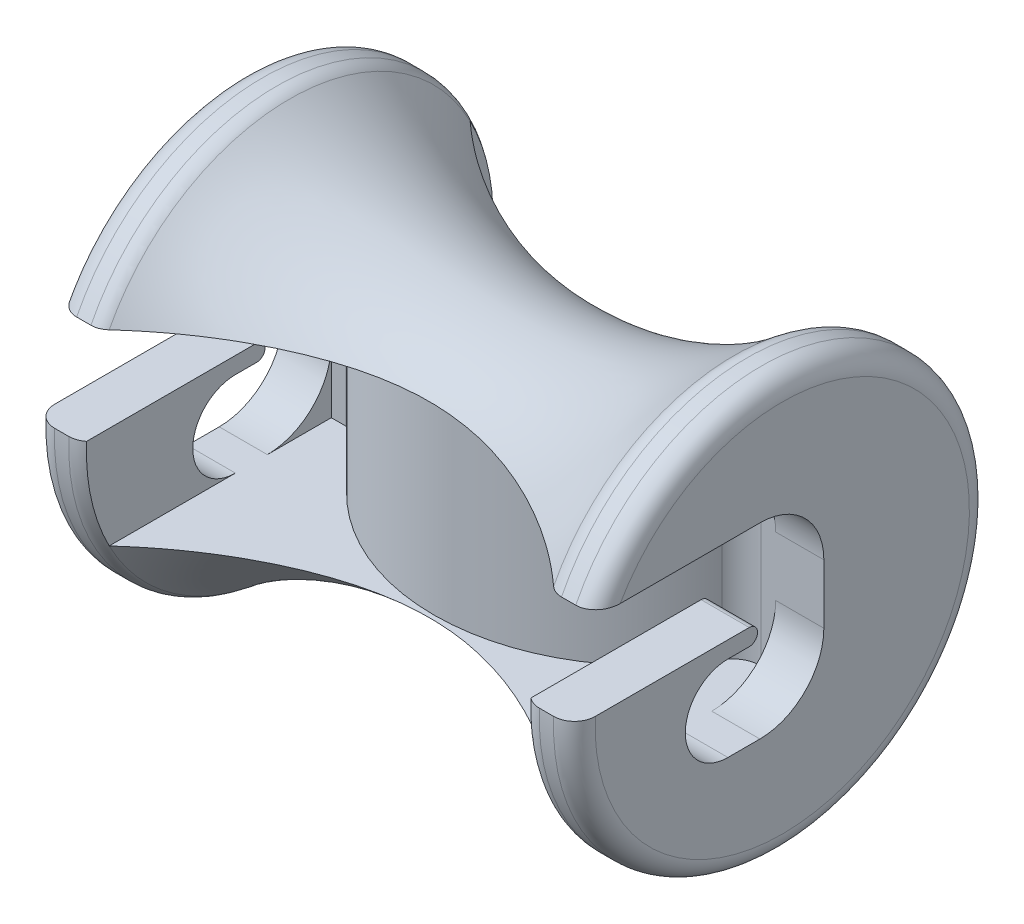
from build123d import *

# Parameters (mm, degrees)
CUT_EXTRUDE1_DEPTH            = 4.5
CUT_EXTRUDE4_REACH            = 31.597
CUT_EXTRUDE5_START            = -2.314830862
CUT_EXTRUDE5_DEPTH            = 2.314830862
CUT_EXTRUDE6_REACH            = 22.975
CUT_EXTRUDE6_END_MAJOR_RADIUS = 23
CUT_EXTRUDE6_END_MINOR_RADIUS = 17
SKETCH10_W                    = 21.370338276
SKETCH10_H                    = 4.1


with BuildPart() as part:
    # Sketch1 → Revolve1 (revolve)
    with BuildSketch(Plane(origin=(0, 0, 0), x_dir=(1, 0, 0), z_dir=(0, 1, 0)), mode=Mode.PRIVATE) as revolve1_sk:
        with BuildLine():
            Line((11.313708499, 10), (12, 10))
            ThreePointArc((12, 10), (12.707106781, 9.707106781), (13, 9))
            Line((13, 9), (13, 0))
            Line((13, 0), (-13, 0))
            Line((-13, 0), (-13, 9))
            ThreePointArc((-13, 9), (-12.707106781, 9.707106781), (-12, 10))
            Line((-12, 10), (-11.313708499, 10))
            ThreePointArc((-11.313708499, 10), (-10.980375166, 9.942809042), (-10.685169138, 9.777777778))
            ThreePointArc((-10.685169138, 9.777777778), (0, 6), (10.685169138, 9.777777778))
            ThreePointArc((10.685169138, 9.777777778), (10.980375166, 9.942809042), (11.313708499, 10))
        make_face()
    revolve(revolve1_sk.sketch.rotate(Axis((-13, 0, 0), (1, 0, 0)), 180), axis=Axis((-13, 0, 0), (1, 0, 0)))

    # Sketch3 → Cut-Extrude1 (cut, symmetric)
    with BuildSketch(Plane(origin=(0, 0, 0), x_dir=(1, 0, 0), z_dir=(0, 1, 0))):
        with BuildLine():
            Line((-9.147669138, -10), (9.147669138, -10))
            Line((9.147669138, -10), (10.685169138, -10))
            Line((10.685169138, -10), (10.685169138, 2))
            Line((10.685169138, 2), (9.969897363, 2))
            ThreePointArc((9.969897363, 2), (9.287033253, 1.817172167), (8.786871434, 1.31760479))
            ThreePointArc((8.786871434, 1.31760479), (0, -3.750854676), (-8.786871434, 1.31760479))
            ThreePointArc((-8.786871434, 1.31760479), (-9.287033253, 1.817172167), (-9.969897363, 2))
            Line((-9.969897363, 2), (-10.685169138, 2))
            Line((-10.685169138, 2), (-10.685169138, -10))
            Line((-10.685169138, -10), (-9.147669138, -10))
        make_face()
    extrude(amount=CUT_EXTRUDE1_DEPTH, both=True, mode=Mode.SUBTRACT)

    # Cut-Extrude4: up to this face of the body (flat: up to its plane)
    cut_extrude4_end = Plane(part.part.faces().sort_by_distance((-10.685169138, 0, 3.71495774))[0])
    # Sketch6 → Cut-Extrude4 (cut, up to the picked face)
    with BuildSketch(Plane.ZY.offset(13), mode=Mode.PRIVATE) as cut_extrude4_sk1:
        with BuildLine():
            Line((1.075, -4.5), (2.6125, -4.5))
            ThreePointArc((2.6125, -4.5), (4.6625, -2.45), (2.6125, -0.4))
            Line((2.6125, -0.4), (1.5875, -0.4))
            ThreePointArc((1.5875, -0.4), (1.1875, 0), (1.5875, 0.4))
            Line((1.5875, 0.4), (9.991996797, 0.4))
            ThreePointArc((9.991996797, 0.4), (9.680686562, 2.506852148), (8.93028555, 4.5))
            Line((8.93028555, 4.5), (1.075, 4.5))
            ThreePointArc((1.075, 4.5), (-1.099353352, 3.599353352), (-2, 1.425))
            Line((-2, 1.425), (-2, -1.425))
            ThreePointArc((-2, -1.425), (-1.099353352, -3.599353352), (1.075, -4.5))
        make_face()
    cut_extrude4_tool1 = split(extrude(cut_extrude4_sk1.sketch, amount=-CUT_EXTRUDE4_REACH, mode=Mode.PRIVATE), bisect_by=cut_extrude4_end, keep=Keep.BOTH, mode=Mode.PRIVATE)
    add(cut_extrude4_tool1.solids().sort_by(Axis((-13, 0.735249, 2.995386), (1, 0, 0)))[0], mode=Mode.SUBTRACT)

    # Sketch8 → Cut-Extrude5 (cut)
    with BuildSketch(Plane(origin=(13, 0, 0), x_dir=(0, 0, -1), z_dir=(1, 0, 0)).offset(CUT_EXTRUDE5_START)):
        with BuildLine():
            Line((-1.5875, 0.4), (-9.991996797, 0.4))
            ThreePointArc((-9.991996797, 0.4), (-9.680686562, 2.506852148), (-8.93028555, 4.5))
            Line((-8.93028555, 4.5), (-1.075, 4.5))
            ThreePointArc((-1.075, 4.5), (1.099353352, 3.599353352), (2, 1.425))
            Line((2, 1.425), (2, -1.425))
            ThreePointArc((2, -1.425), (1.099353352, -3.599353352), (-1.075, -4.5))
            Line((-1.075, -4.5), (-2.6125, -4.5))
            ThreePointArc((-2.6125, -4.5), (-4.6625, -2.45), (-2.6125, -0.4))
            Line((-2.6125, -0.4), (-1.5875, -0.4))
            ThreePointArc((-1.5875, -0.4), (-1.1875, 0), (-1.5875, 0.4))
        make_face()
    extrude(amount=CUT_EXTRUDE5_DEPTH, mode=Mode.SUBTRACT)

    # Cut-Extrude6: up to this torus (the profile starts outside it)
    cut_extrude6_end = Plane(origin=(0, 0, 0), z_dir=(-1, 0, 0)) * Torus(CUT_EXTRUDE6_END_MAJOR_RADIUS, CUT_EXTRUDE6_END_MINOR_RADIUS, mode=Mode.PRIVATE)
    # Sketch10 → Cut-Extrude6 (cut, up to the surface)
    with BuildSketch(Plane.XY.offset(-3.075), mode=Mode.PRIVATE) as cut_extrude6_sk1:
        with Locations((0, 2.46)):
            Rectangle(SKETCH10_W, SKETCH10_H)
    cut_extrude6_tool1 = extrude(cut_extrude6_sk1.sketch, amount=-CUT_EXTRUDE6_REACH, mode=Mode.PRIVATE) - cut_extrude6_end
    add(cut_extrude6_tool1.solids().sort_by_distance((0, 2.46, -3.075))[0], mode=Mode.SUBTRACT)
    # Sketch10 → Cut-Extrude6 (cut, up to the surface)
    with BuildSketch(Plane.XY.offset(-3.075), mode=Mode.PRIVATE) as cut_extrude6_sk2:
        with Locations((0, -2.46)):
            Rectangle(SKETCH10_W, SKETCH10_H)
    cut_extrude6_tool2 = extrude(cut_extrude6_sk2.sketch, amount=-CUT_EXTRUDE6_REACH, mode=Mode.PRIVATE) - cut_extrude6_end
    add(cut_extrude6_tool2.solids().sort_by_distance((0, -2.46, -3.075))[0], mode=Mode.SUBTRACT)


solid = part.part
